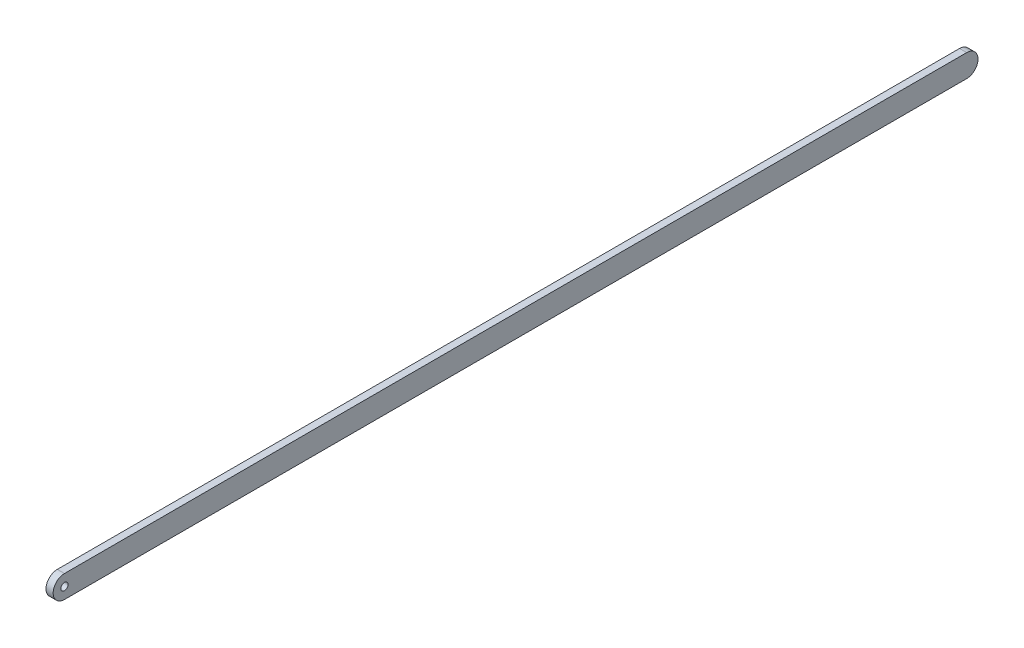
from build123d import *

# Parameters (mm, degrees)
BOSS_EXTRUDE1_DEPTH      = 3.175
M3_CLEARANCE_HOLE1_D     = 3.2
M3_CLEARANCE_HOLE1_DEPTH = 3.03862301
M3_CLEARANCE_HOLE1_TIP   = 0.96137699


with BuildPart() as part:
    # Sketch1 → Boss-Extrude1 (new body)
    with BuildSketch(Plane(origin=(0, 0, 0), x_dir=(0, 0, -1), z_dir=(1, 0, 0))):
        with BuildLine():
            Line((-200, 5), (200, 5))
            ThreePointArc((200, 5), (205, 0), (200, -5))
            Line((200, -5), (-200, -5))
            ThreePointArc((-200, -5), (-205, 0), (-200, 5))
        make_face()
    extrude(amount=BOSS_EXTRUDE1_DEPTH)

    # M3 Clearance Hole1
    with Locations(Plane(origin=(3.175, 0, 0), x_dir=(0, 0, -1), z_dir=(1, 0, 0))):
        with Locations((-200, 0)):
            Hole(M3_CLEARANCE_HOLE1_D / 2, depth=M3_CLEARANCE_HOLE1_DEPTH)
            with Locations((0, 0, -(M3_CLEARANCE_HOLE1_DEPTH + M3_CLEARANCE_HOLE1_TIP / 2))):  # 118° drill point
                Cone(0, M3_CLEARANCE_HOLE1_D / 2, M3_CLEARANCE_HOLE1_TIP, mode=Mode.SUBTRACT)


solid = part.part
